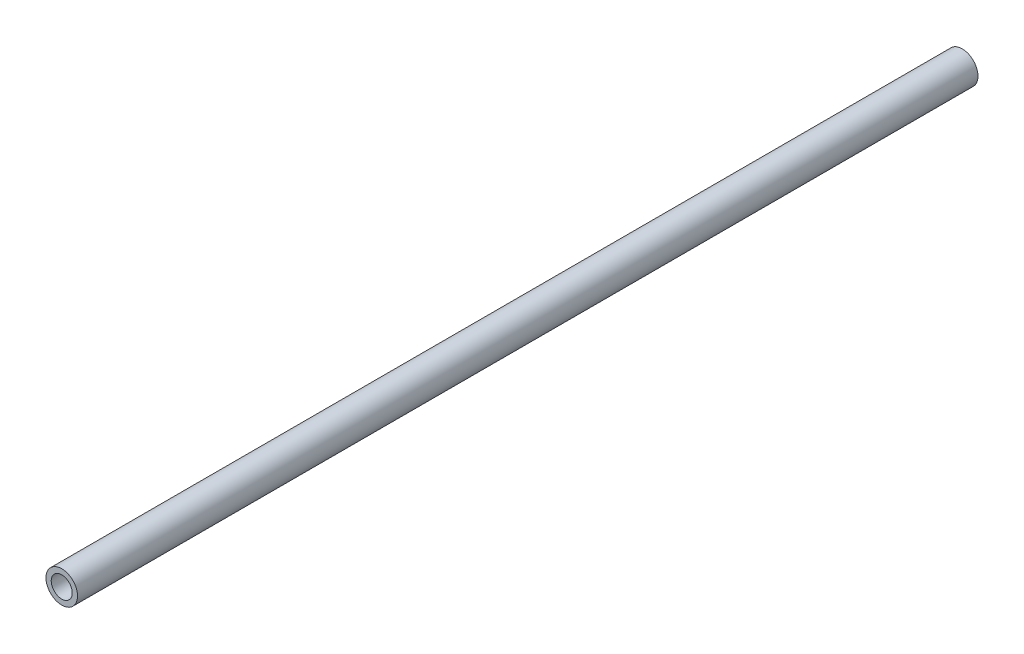
from build123d import *

# Parameters (mm, degrees)
SKETCH1_R           = 9.525
SKETCH1_R_2         = 6.35
BOSS_EXTRUDE1_DEPTH = 543.75


with BuildPart() as part:
    # Sketch1 → Boss-Extrude1 (new body)
    with BuildSketch(Plane.XY):
        Circle(SKETCH1_R)
        Circle(SKETCH1_R_2, mode=Mode.SUBTRACT)
    extrude(amount=-BOSS_EXTRUDE1_DEPTH)


solid = part.part
